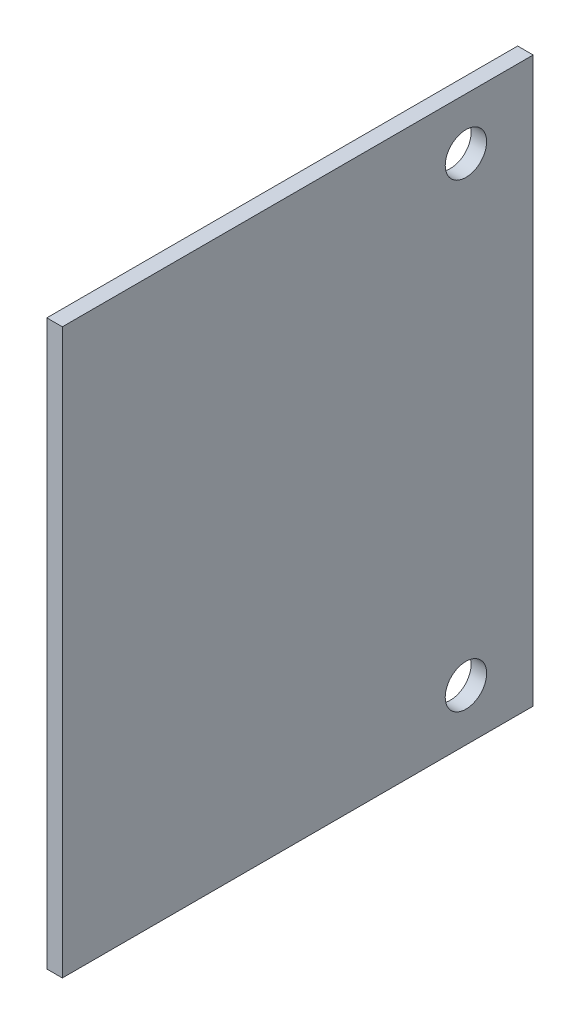
from build123d import *

# Parameters (mm, degrees)
SKETCH1_W           = 19.05
SKETCH1_H           = 577.85
BOSS_EXTRUDE1_DEPTH = 692.15
SKETCH2_R           = 25.4
CUT_EXTRUDE1_DEPTH  = 754.993983729


with BuildPart() as part:
    # Sketch1 → Boss-Extrude1 (new body)
    with BuildSketch(Plane(origin=(0, 0, 0), x_dir=(1, 0, 0), z_dir=(0, 1, 0))):
        with Locations((-466.725, 9.525)):
            Rectangle(SKETCH1_W, SKETCH1_H)
    extrude(amount=BOSS_EXTRUDE1_DEPTH)

    # Sketch2 → Cut-Extrude1 (cut, through all)
    with BuildSketch(Plane.ZY.offset(476.25)):
        with Locations((-215.9, 628.65)):
            Circle(SKETCH2_R)
        with Locations((-215.9, 63.5)):
            Circle(SKETCH2_R)
    extrude(amount=-CUT_EXTRUDE1_DEPTH, mode=Mode.SUBTRACT)


solid = part.part
